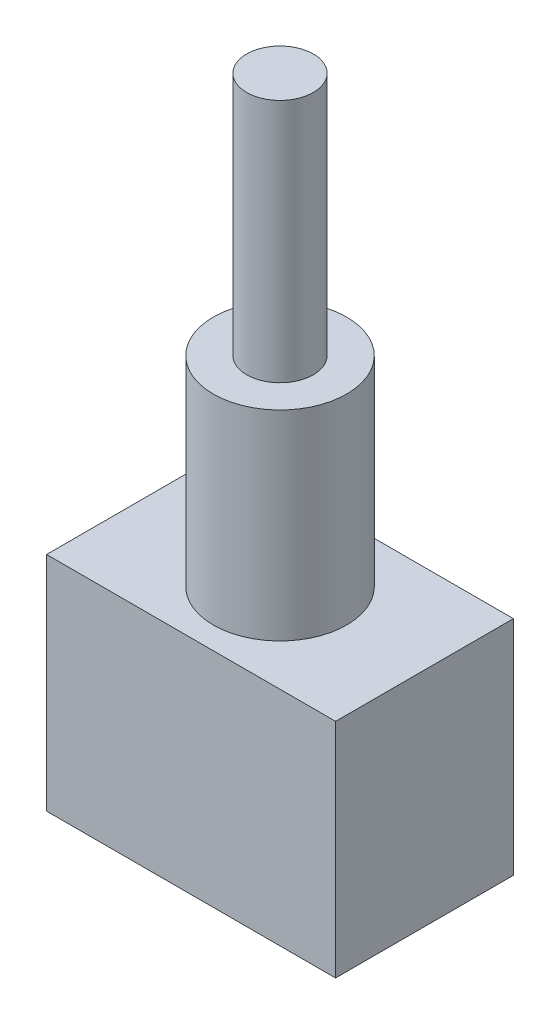
from build123d import *

# Parameters (mm, degrees)
SKETCH1_W           = 13
SKETCH1_H           = 8
BOSS_EXTRUDE1_DEPTH = 10
SKETCH2_R           = 3
BOSS_EXTRUDE2_DEPTH = 9
SKETCH3_R           = 1.5
BOSS_EXTRUDE3_DEPTH = 11


with BuildPart() as part:
    # Sketch1 → Boss-Extrude1 (new body)
    with BuildSketch(Plane(origin=(0, 0, 0), x_dir=(1, 0, 0), z_dir=(0, 1, 0))):
        with Locations((6.5, 4)):
            Rectangle(SKETCH1_W, SKETCH1_H)
    extrude(amount=BOSS_EXTRUDE1_DEPTH)

    # Sketch2 → Boss-Extrude2 (add)
    with BuildSketch(Plane(origin=(0, 10, 0), x_dir=(1, 0, 0), z_dir=(0, 1, 0))):
        with Locations(Location((6.5, 4, 0), (0, 0, 270))):
            Circle(SKETCH2_R)
    extrude(amount=BOSS_EXTRUDE2_DEPTH)

    # Sketch3 → Boss-Extrude3 (add)
    with BuildSketch(Plane(origin=(0, 19, 0), x_dir=(1, 0, 0), z_dir=(0, 1, 0))):
        with Locations(Location((6.5, 4, 0), (0, 0, 270))):
            Circle(SKETCH3_R)
    extrude(amount=BOSS_EXTRUDE3_DEPTH)


solid = part.part
